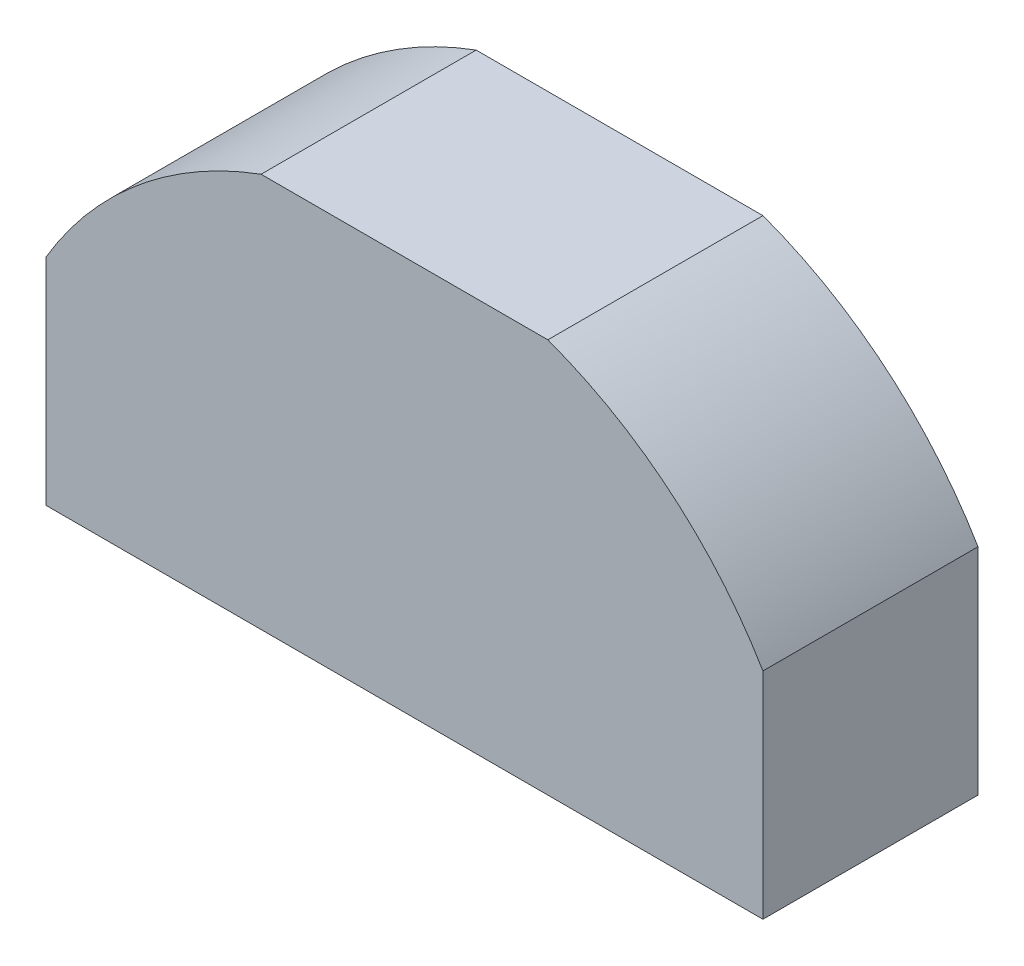
from build123d import *

# Parameters (mm, degrees)
BOSS_EXTRUDE1_DEPTH = 3


with BuildPart() as part:
    # Sketch1 → Boss-Extrude1 (new body)
    with BuildSketch(Plane.XY):
        with BuildLine():
            Line((5, 0), (-5, 0))
            Line((-5, 0), (-5, 3))
            ThreePointArc((-5, 3), (-3.716517187, 4.509820624), (-2, 5.5))
            Line((-2, 5.5), (2, 5.5))
            ThreePointArc((2, 5.5), (3.716517187, 4.509820624), (5, 3))
            Line((5, 3), (5, 0))
        make_face()
    extrude(amount=BOSS_EXTRUDE1_DEPTH)


solid = part.part
